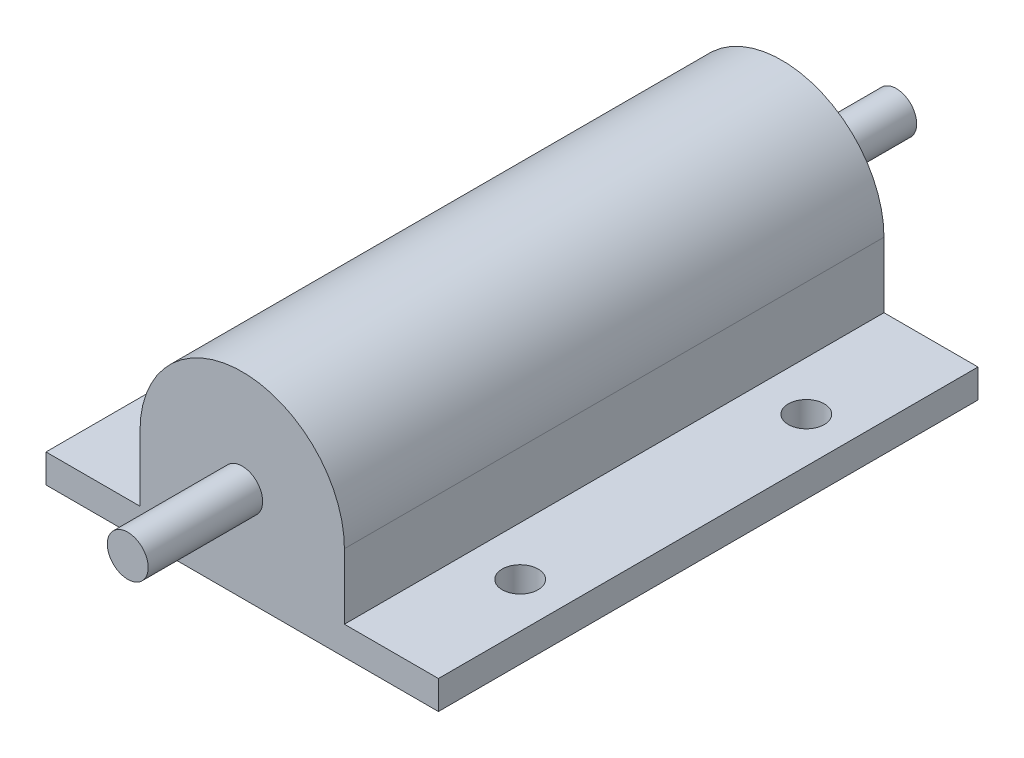
from build123d import *

# Parameters (mm, degrees)
BOSS_EXTRUDE1_DEPTH = 33
SKETCH2_R           = 2.2
CUT_EXTRUDE1_DEPTH  = 46.664537663
SKETCH3_R           = 2.5
BOSS_EXTRUDE2_DEPTH = 14


with BuildPart() as part:
    # Sketch1 → Boss-Extrude1 (new, symmetric)
    with BuildSketch(Plane.XY):
        with BuildLine():
            Line((12.5, -8), (24, -8))
            Line((24, -8), (24, -11.5))
            Line((24, -11.5), (-24, -11.5))
            Line((-24, -11.5), (-24, -8))
            Line((-24, -8), (-12.5, -8))
            Line((-12.5, -8), (-12.5, 0))
            ThreePointArc((-12.5, 0), (0, 12.5), (12.5, 0))
            Line((12.5, 0), (12.5, -8))
        make_face()
    extrude(amount=BOSS_EXTRUDE1_DEPTH, both=True)

    # Sketch2 → Cut-Extrude1 (cut, through all)
    with BuildSketch(Plane(origin=(0, -8, 0), x_dir=(1, 0, 0), z_dir=(0, 1, 0))):
        with Locations(Location((-18.5, 17.5, 0), (0, 0, 270))):
            Circle(SKETCH2_R)
        with Locations(Location((-18.5, -17.5, 0), (0, 0, 270))):
            Circle(SKETCH2_R)
        with Locations(Location((18.5, -17.5, 0), (0, 0, 270))):
            Circle(SKETCH2_R)
        with Locations(Location((18.5, 17.5, 0), (0, 0, 270))):
            Circle(SKETCH2_R)
    extrude(amount=-CUT_EXTRUDE1_DEPTH, mode=Mode.SUBTRACT)

    # Sketch3 → Boss-Extrude2 (add)
    with BuildSketch(Plane.XY.offset(33)):
        Circle(SKETCH3_R)
    boss_extrude2 = extrude(amount=BOSS_EXTRUDE2_DEPTH)

    # Mirror5: Boss-Extrude2 across plane
    add(boss_extrude2.mirror(Plane.XY))


solid = part.part
